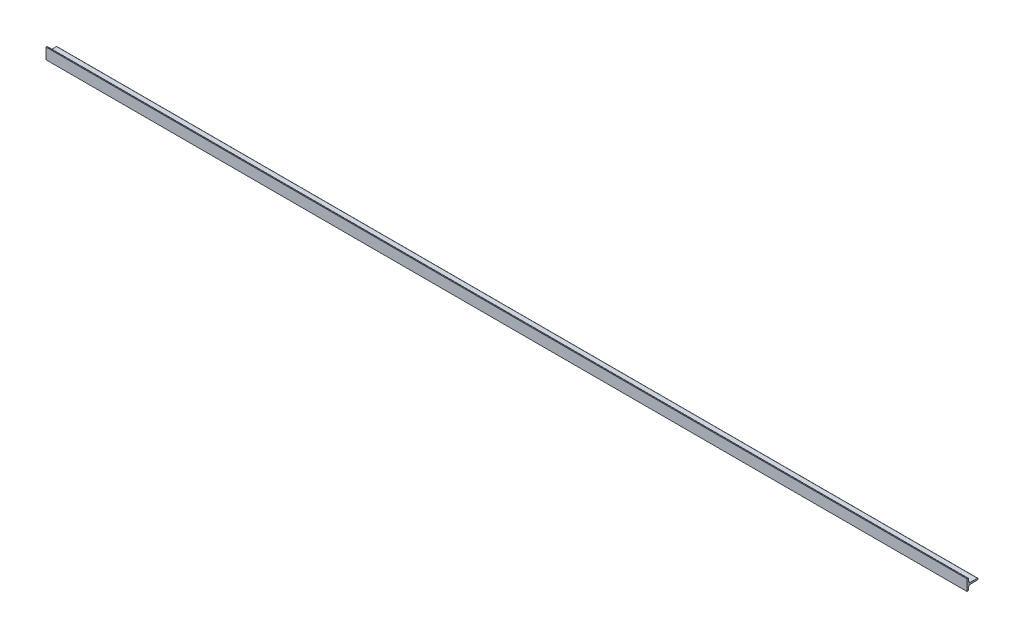
from build123d import *

# Parameters (mm, degrees)
T_SECTION_T_20_X_20_1_DEPTH = 1674


with BuildPart() as part:
    # Sketch12 → T section T 20 X 20(1) (new body)
    with BuildSketch(Plane.YZ):
        with BuildLine():
            Line((-10, 20), (10, 20))
            Line((10, 20), (10, 18.570314587))
            ThreePointArc((10, 18.570314587), (9.571214338, 17.520314662), (8.530000209, 17.070614622))
            Line((8.530000209, 17.070614622), (4.520436432, 16.990406743))
            ThreePointArc((4.520436432, 16.990406743), (2.459116507, 16.112327155), (1.581036919, 14.05100723))
            Line((1.581036919, 14.05100723), (1.319562646, 0.97999986))
            ThreePointArc((1.319562646, 0.97999986), (1.019762619, 0.285857108), (0.319762669, 0))
            Line((0.319762669, 0), (-0.319762669, 0))
            ThreePointArc((-0.319762669, 0), (-1.019762619, 0.285857108), (-1.319562646, 0.97999986))
            Line((-1.319562646, 0.97999986), (-1.581036919, 14.05100723))
            ThreePointArc((-1.581036919, 14.05100723), (-2.459116507, 16.112327155), (-4.520436432, 16.990406743))
            Line((-4.520436432, 16.990406743), (-8.530000209, 17.070614622))
            ThreePointArc((-8.530000209, 17.070614622), (-9.571214338, 17.520314662), (-10, 18.570314587))
            Line((-10, 18.570314587), (-10, 20))
        make_face()
    extrude(amount=T_SECTION_T_20_X_20_1_DEPTH)


solid = part.part
